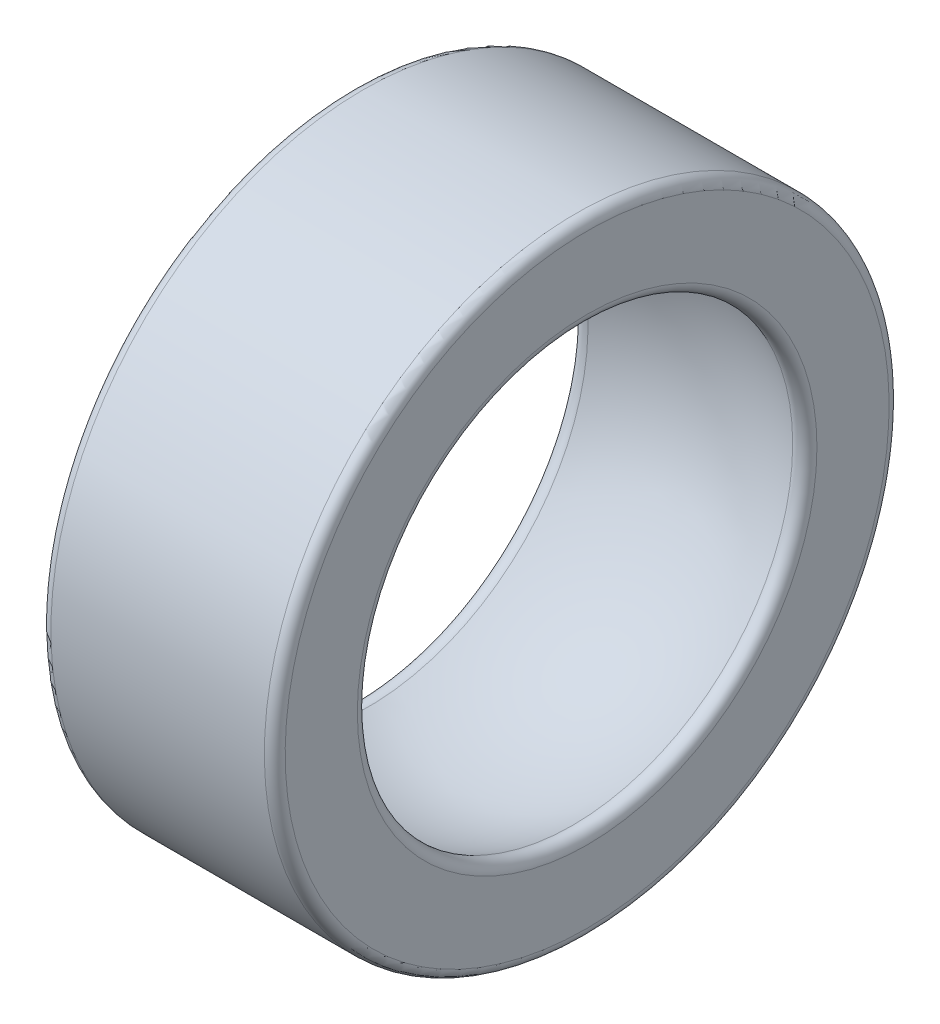
from build123d import *

# Parameters (mm, degrees)
FILLET_1_R = 0.3


with BuildPart() as part:
    # 草图1 → 旋转1 (revolve)
    with BuildSketch(Plane.XY, mode=Mode.PRIVATE) as revolve_1_sk:
        with BuildLine():
            Line((-3.375, 6.132648286), (-3.375, 9))
            Line((-3.375, 9), (3.375, 9))
            Line((3.375, 9), (3.375, 6.132648286))
            ThreePointArc((3.375, 6.132648286), (0, 7), (-3.375, 6.132648286))
        make_face()
    revolve(revolve_1_sk.sketch.rotate(Axis((-8.353570551, 0, 0), (1, 0, 0)), 180), axis=Axis((-8.353570551, 0, 0), (1, 0, 0)))

    # 圆角1
    fillet_1_edges = [part.edges().sort_by_distance(p)[0] for p in [
        (3.375, 6.132648286, 0),
        (-3.375, 6.132648286, 0),
        (-3.375, 9, 0),
        (3.375, 9, 0),
    ]]
    fillet(fillet_1_edges, radius=FILLET_1_R)


solid = part.part
